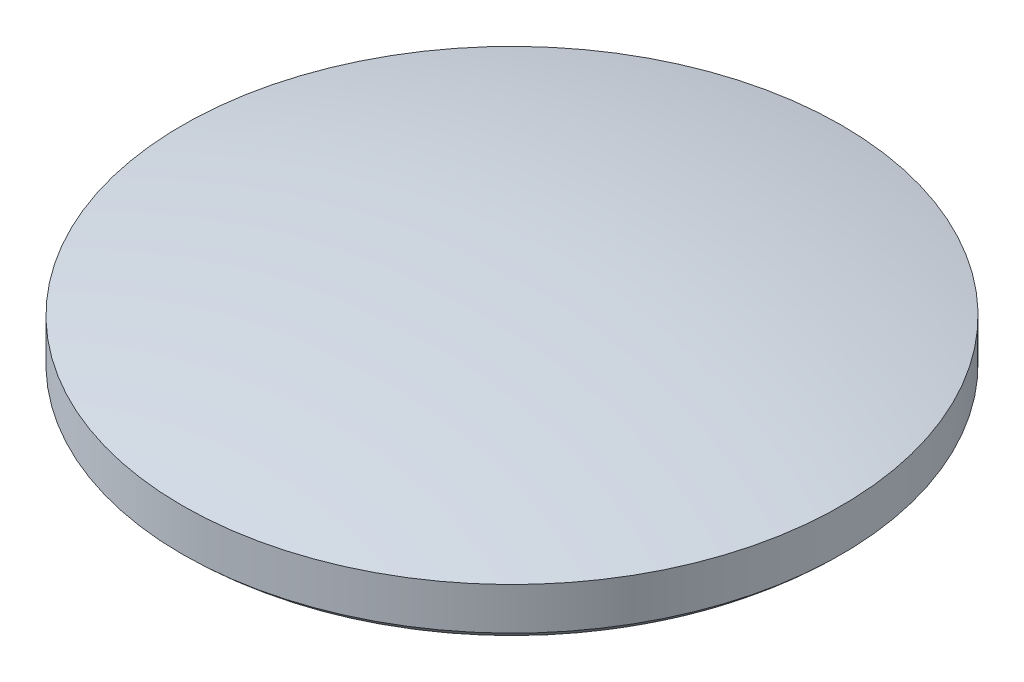
from build123d import *


with BuildPart() as part:
    # 草图1 → 旋转1 (revolve)
    with BuildSketch(Plane.XY, mode=Mode.PRIVATE) as revolve_1_sk:
        with BuildLine():
            Line((23.477136306, 0), (23.477136306, 3))
            ThreePointArc((23.477136306, 3), (11.823004818, 5.103529694), (0, 5.781891667))
            Line((0, 5.781891667), (0, -1.207688952))
            Line((0, -1.207688952), (21.982415225, -1.207688952))
            ThreePointArc((21.982415225, -1.207688952), (22.759323057, -0.640414289), (23.477136306, 0))
        make_face()
    revolve(revolve_1_sk.sketch.rotate(Axis((0, 8.931235369, 0), (0, -1, 0)), 90), axis=Axis((0, 8.931235369, 0), (0, -1, 0)))


solid = part.part
